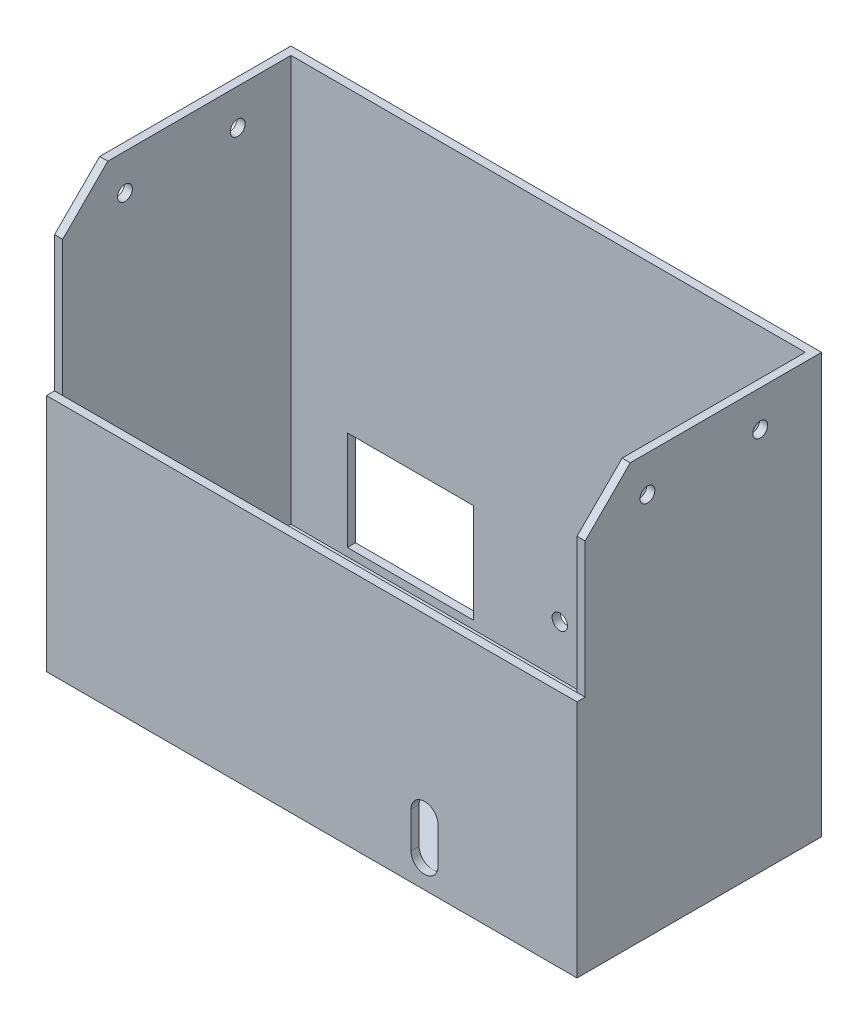
from build123d import *

# Parameters (mm, degrees)
SKETCH2_W           = 117.6
SKETCH2_H           = 54.2
BOSS_EXTRUDE1_DEPTH = 3
SKETCH3_W           = 117.6
SKETCH3_H           = 54.2
SKETCH3_W_2         = 114
SKETCH3_H_2         = 50.6
BOSS_EXTRUDE2_DEPTH = 50
BOSS_EXTRUDE3_DEPTH = 40
CHAMFER1_SIZE       = 10
SKETCH5_R           = 1.65
CUT_EXTRUDE1_DEPTH  = 153.358688627
CUT_EXTRUDE2_REACH  = 124.654
SKETCH6_R           = 1.7
SKETCH6_W           = 28
SKETCH6_H           = 19.6
SKETCH6_H_2         = 22
CUT_EXTRUDE3_REACH  = 124.654


with BuildPart() as part:
    # Sketch2 → Boss-Extrude1 (new body)
    with BuildSketch(Plane(origin=(0, 0, 0), x_dir=(1, 0, 0), z_dir=(0, 1, 0))):
        Rectangle(SKETCH2_W, SKETCH2_H)
    extrude(amount=BOSS_EXTRUDE1_DEPTH)

    # Sketch3 → Boss-Extrude2 (add)
    with BuildSketch(Plane(origin=(0, 3, 0), x_dir=(1, 0, 0), z_dir=(0, 1, 0))):
        Rectangle(SKETCH3_W, SKETCH3_H)
        Rectangle(SKETCH3_W_2, SKETCH3_H_2, mode=Mode.SUBTRACT)
    extrude(amount=BOSS_EXTRUDE2_DEPTH)

    # Sketch4 → Boss-Extrude3 (add)
    with BuildSketch(Plane(origin=(0, 53, 0), x_dir=(1, 0, 0), z_dir=(0, 1, 0))):
        Polygon((57, -25.3), (57, 25.3), (-57, 25.3), (-57, -25.3), (-58.8, -25.3), (-58.8, 27.1), (58.8, 27.1), (58.8, -25.3), align=None)
    extrude(amount=BOSS_EXTRUDE3_DEPTH)

    # Chamfer1
    chamfer1_edges = [part.edges().sort_by_distance(p)[0] for p in [
        (-57.9, 93, 25.3),
        (57.9, 93, 25.3),
    ]]
    chamfer(chamfer1_edges, length=CHAMFER1_SIZE)

    # Sketch5 → Cut-Extrude1 (cut, through all)
    with BuildSketch(Plane.ZY.offset(58.8)):
        with Locations((11.5, 85)):
            Circle(SKETCH5_R)
        with Locations((-13.5, 85)):
            Circle(SKETCH5_R)
    extrude(amount=-CUT_EXTRUDE1_DEPTH, mode=Mode.SUBTRACT)

    # Sketch6 → Cut-Extrude2 (cut, up to next)
    with BuildSketch(Plane(origin=(0, 0, -27.1), x_dir=(-1, 0, 0), z_dir=(0, 0, -1)), mode=Mode.PRIVATE) as cut_extrude2_sk1:
        with Locations((-2.575, 14.075)):
            Circle(SKETCH6_R)
    cut_extrude2_tool1 = extrude(cut_extrude2_sk1.sketch, amount=-CUT_EXTRUDE2_REACH, mode=Mode.PRIVATE) & part.part
    # Sketch6 → Cut-Extrude2 (cut, up to next)
    with BuildSketch(Plane(origin=(0, 0, -27.1), x_dir=(-1, 0, 0), z_dir=(0, 0, -1)), mode=Mode.PRIVATE) as cut_extrude2_sk2:
        with Locations((-44.275, 14.075)):
            Circle(SKETCH6_R)
    cut_extrude2_tool2 = extrude(cut_extrude2_sk2.sketch, amount=-CUT_EXTRUDE2_REACH, mode=Mode.PRIVATE) & part.part
    # Sketch6 → Cut-Extrude2 (cut, up to next)
    with BuildSketch(Plane(origin=(0, 0, -27.1), x_dir=(-1, 0, 0), z_dir=(0, 0, -1)), mode=Mode.PRIVATE) as cut_extrude2_sk3:
        with Locations((-25.4, 14)):
            Rectangle(SKETCH6_W, SKETCH6_H)
    cut_extrude2_tool3 = extrude(cut_extrude2_sk3.sketch, amount=-CUT_EXTRUDE2_REACH, mode=Mode.PRIVATE) & part.part
    # Sketch6 → Cut-Extrude2 (cut, up to next)
    with BuildSketch(Plane(origin=(0, 0, -27.1), x_dir=(-1, 0, 0), z_dir=(0, 0, -1)), mode=Mode.PRIVATE) as cut_extrude2_sk4:
        with Locations((30.5, 15.8)):
            Rectangle(SKETCH6_W, SKETCH6_H_2)
    cut_extrude2_tool4 = extrude(cut_extrude2_sk4.sketch, amount=-CUT_EXTRUDE2_REACH, mode=Mode.PRIVATE) & part.part
    add(cut_extrude2_tool1.solids().sort_by_distance((2.575, 14.075, -27.1))[0], mode=Mode.SUBTRACT)
    add(cut_extrude2_tool2.solids().sort_by_distance((44.275, 14.075, -27.1))[0], mode=Mode.SUBTRACT)
    add(cut_extrude2_tool3.solids().sort_by_distance((25.4, 14, -27.1))[0], mode=Mode.SUBTRACT)
    add(cut_extrude2_tool4.solids().sort_by_distance((-30.5, 15.8, -27.1))[0], mode=Mode.SUBTRACT)

    # Sketch7 → Cut-Extrude3 (cut, up to next)
    with BuildSketch(Plane.XY.offset(27.1), mode=Mode.PRIVATE) as cut_extrude3_sk1:
        with BuildLine():
            Line((22, 6), (22, 14))
            ThreePointArc((22, 14), (25, 17), (28, 14))
            Line((28, 14), (28, 6))
            ThreePointArc((28, 6), (25, 3), (22, 6))
        make_face()
    cut_extrude3_tool1 = extrude(cut_extrude3_sk1.sketch, amount=-CUT_EXTRUDE3_REACH, mode=Mode.PRIVATE) & part.part
    add(cut_extrude3_tool1.solids().sort_by_distance((25, 10, 27.1))[0], mode=Mode.SUBTRACT)


solid = part.part
